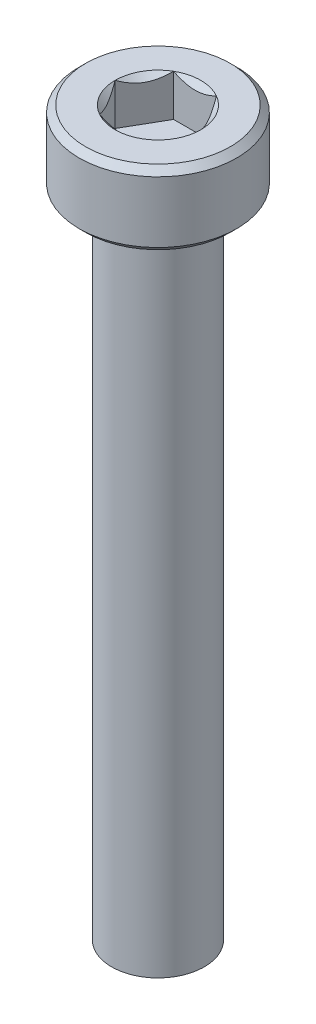
from build123d import *

# Parameters (mm, degrees)
SKETCH1_R           = 4.25
BOSS_EXTRUDE1_DEPTH = 4
CUT_EXTRUDE1_DEPTH  = 2.25
CHAMFER1_SIZE       = 0.35
SKETCH_1_R          = 2.5
EXTRUDE_1_DEPTH     = 35


with BuildPart() as part:
    # Sketch1 → Boss-Extrude1 (new body)
    with BuildSketch(Plane(origin=(0, 0, 0), x_dir=(1, 0, 0), z_dir=(0, 1, 0))):
        with Locations(Location((0, 0, 0), (0, 0, 270))):
            Circle(SKETCH1_R)
    extrude(amount=BOSS_EXTRUDE1_DEPTH)

    # Sketch2 → Cut-Extrude1 (cut)
    with BuildSketch(Plane(origin=(0, 4, 0), x_dir=(1, 0, 0), z_dir=(0, 1, 0))):
        Polygon((1.154700538, 2), (-1.154700538, 2), (-2.309401077, 0), (-1.154700538, -2), (1.154700538, -2), (2.309401077, 0), align=None)
    extrude(amount=-CUT_EXTRUDE1_DEPTH, mode=Mode.SUBTRACT)

    # Cut-Extrude2 cone 1 section (through the dimple's axis) → Cut-Extrude2 (revolve, cut)
    with BuildSketch(Plane(origin=(0, 4, 0), x_dir=(0, 0, 1), z_dir=(1, 0, 0))):
        Polygon((0, 0), (2.309401077, 0), (0, 2.309401077), align=None)
    revolve(axis=Axis((0, 4, 0), (0, -1, 0)), mode=Mode.SUBTRACT)

    # Chamfer1
    chamfer1_edges = [part.edges().sort_by_distance(p)[0] for p in [
        (0, 0, -4.25),
        (0, 4, -4.25),
    ]]
    chamfer(chamfer1_edges, length=CHAMFER1_SIZE)

    # 草图1 → 凸台-拉伸1 (add)
    with BuildSketch(Plane(origin=(0, 0, 0), x_dir=(-1, 0, 0), z_dir=(0, -1, 0))):
        with Locations(Location((0, 0, 0), (0, 0, 90))):
            Circle(SKETCH_1_R)
    extrude(amount=EXTRUDE_1_DEPTH)


solid = part.part
